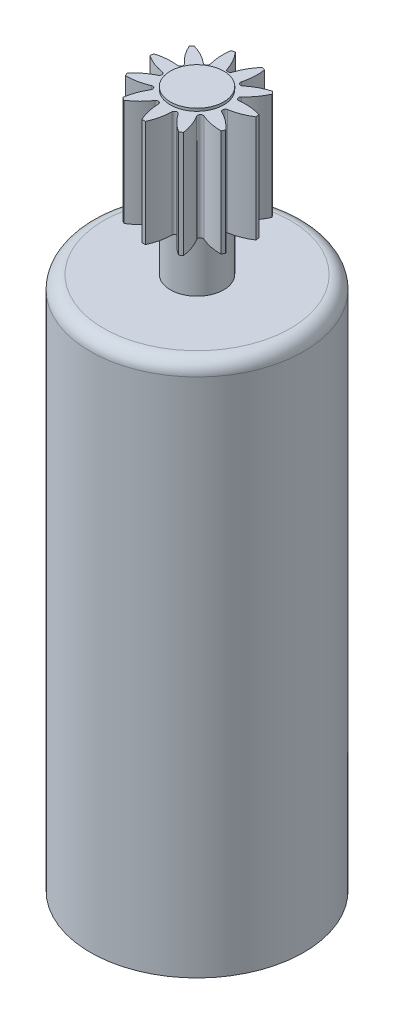
from build123d import *

# Parameters (mm, degrees)
CUT_EXTRUDE_START        = -5
CUT_EXTRUDE_1_DEPTH      = 5
PATTERN_CIRCULAR_1_COUNT = 11


with BuildPart() as part:
    # 草图2 → 旋转1 (revolve)
    with BuildSketch(Plane.XY, mode=Mode.PRIVATE) as revolve_1_sk:
        with BuildLine():
            Line((0, 0), (0, 26.1))
            Line((0, 26.1), (1, 26.1))
            Line((1, 26.1), (1, 26))
            Line((1, 26), (2, 26))
            Line((2, 26), (2, 22))
            Line((2, 22), (1, 22))
            Line((1, 22), (1, 20))
            Line((1, 20), (3.5, 20))
            ThreePointArc((3.5, 20), (3.853553391, 19.853553391), (4, 19.5))
            Line((4, 19.5), (4, 0))
            Line((4, 0), (0, 0))
        make_face()
    revolve(revolve_1_sk.sketch.rotate(Axis((0, 0, 0), (0, 1, 0)), 90), axis=Axis((0, 0, 0), (0, 1, 0)))

    # 草图8 → 切除-拉伸1 (cut)
    with BuildSketch(Plane(origin=(0, 26, 0), x_dir=(1, 0, 0), z_dir=(0, 1, 0)).offset(CUT_EXTRUDE_START)):
        with BuildLine():
            ThreePointArc((-0.5, 1.936491673), (0, 2), (0.5, 1.936491673))
            ThreePointArc((0.5, 1.936491673), (0.260400333, 1.599188187), (0.095331419, 1.219801979))
            ThreePointArc((0.095331419, 1.219801979), (0, 1.15), (-0.095331419, 1.219801979))
            ThreePointArc((-0.095331419, 1.219801979), (-0.260400333, 1.599188187), (-0.5, 1.936491673))
        make_face()
    cut_extrude_1 = extrude(amount=CUT_EXTRUDE_1_DEPTH, mode=Mode.SUBTRACT)

    # 阵列(圆周)1: 切除-拉伸1 ×11 about axis
    pattern_circular_1_axis = Axis((0, 0, 0), (0, 1, 0))
    for i in range(1, PATTERN_CIRCULAR_1_COUNT):
        add(cut_extrude_1.rotate(pattern_circular_1_axis, i * 360 / PATTERN_CIRCULAR_1_COUNT), mode=Mode.SUBTRACT)


solid = part.part
